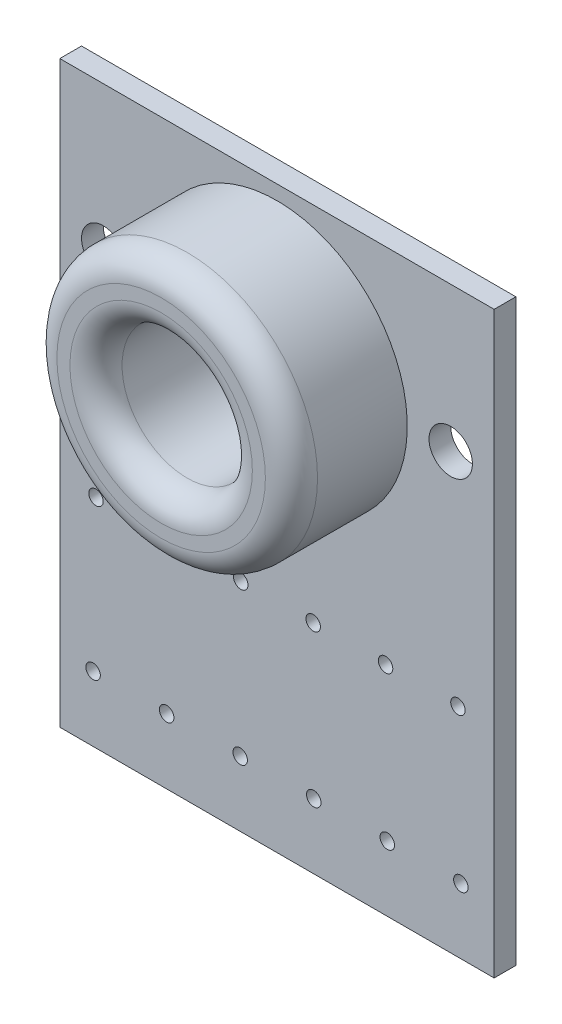
from build123d import *

# Parameters (mm, degrees)
SKETCH_1_W      = 30
SKETCH_1_H      = 40
SKETCH_1_R      = 0.5
SKETCH_1_R_2    = 2
SKETCH_1_R_3    = 1.5
EXTRUDE_1_DEPTH = 1.5
SKETCH_2_R      = 9
SKETCH_2_R_2    = 4.5
EXTRUDE_2_DEPTH = 8
FILLET_1_R      = 1.8


with BuildPart() as part:
    # Эскиз1 → Вытянуть1 (new body)
    with BuildSketch(Plane.XY):
        Rectangle(SKETCH_1_W, SKETCH_1_H)
        with Locations((-12.7, -15.5)):
            Circle(SKETCH_1_R, mode=Mode.SUBTRACT)
        with Locations((-12.5, -5)):
            Circle(SKETCH_1_R, mode=Mode.SUBTRACT)
        with Locations((-7.62, -15.5)):
            Circle(SKETCH_1_R, mode=Mode.SUBTRACT)
        with Locations((-2.54, -15.5)):
            Circle(SKETCH_1_R, mode=Mode.SUBTRACT)
        with Locations((2.54, -15.5)):
            Circle(SKETCH_1_R, mode=Mode.SUBTRACT)
        with Locations((7.62, -15.5)):
            Circle(SKETCH_1_R, mode=Mode.SUBTRACT)
        with Locations((12.7, -15.5)):
            Circle(SKETCH_1_R, mode=Mode.SUBTRACT)
        with Locations((-7.5, -5)):
            Circle(SKETCH_1_R, mode=Mode.SUBTRACT)
        with Locations((-2.5, -5)):
            Circle(SKETCH_1_R, mode=Mode.SUBTRACT)
        with Locations((2.5, -5)):
            Circle(SKETCH_1_R, mode=Mode.SUBTRACT)
        with Locations((7.5, -5)):
            Circle(SKETCH_1_R, mode=Mode.SUBTRACT)
        with Locations((12.5, -5)):
            Circle(SKETCH_1_R, mode=Mode.SUBTRACT)
        with Locations((0, 10)):
            Circle(SKETCH_1_R_2, mode=Mode.SUBTRACT)
        with Locations((-12, 10)):
            Circle(SKETCH_1_R_3, mode=Mode.SUBTRACT)
        with Locations(Location((12, 10, 0), (0, 0, 180))):
            Circle(SKETCH_1_R_3, mode=Mode.SUBTRACT)
    extrude(amount=EXTRUDE_1_DEPTH)

    # Эскиз2 → Вытянуть2 (add)
    with BuildSketch(Plane.XY.offset(1.5)):
        with Locations(Location((0, 10, 0), (0, 0, 180))):
            Circle(SKETCH_2_R)
        with Locations((0, 10)):
            Circle(SKETCH_2_R_2, mode=Mode.SUBTRACT)
    extrude(amount=EXTRUDE_2_DEPTH)

    # Скругление1
    fillet_1_edges = [part.edges().sort_by_distance(p)[0] for p in [
        (9, 10, 9.5),
        (-4.5, 10, 9.5),
    ]]
    fillet(fillet_1_edges, radius=FILLET_1_R)


solid = part.part
